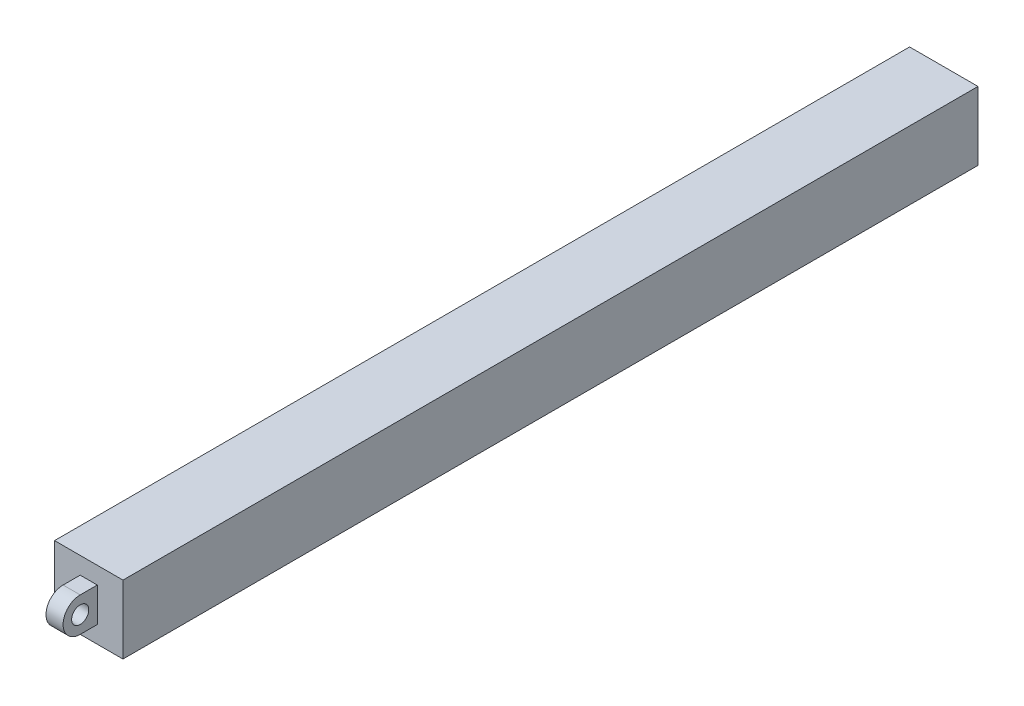
from build123d import *

# Parameters (mm, degrees)
SKETCH_2_W      = 125
SKETCH_2_H      = 10
EXTRUDE_1_DEPTH = 5
SKETCH_3_R      = 1.25
EXTRUDE_2_DEPTH = 1.25


with BuildPart() as part:
    # 스케치2 → 보스-돌출1 (new, symmetric)
    with BuildSketch(Plane(origin=(0, 0, 0), x_dir=(0, 0, -1), z_dir=(1, 0, 0))):
        Rectangle(SKETCH_2_W, SKETCH_2_H)
    extrude(amount=EXTRUDE_1_DEPTH, both=True)

    # 스케치3 → 보스-돌출2 (add, symmetric)
    with BuildSketch(Plane(origin=(0, 0, 0), x_dir=(0, 0, -1), z_dir=(1, 0, 0))):
        with BuildLine():
            Line((-65, 2.5), (-62.5, 2.5))
            Line((-62.5, 2.5), (-62.5, -2.5))
            Line((-62.5, -2.5), (-65, -2.5))
            ThreePointArc((-65, -2.5), (-67.5, 0), (-65, 2.5))
        make_face()
        with Locations((-65, 0)):
            Circle(SKETCH_3_R, mode=Mode.SUBTRACT)
    extrude(amount=EXTRUDE_2_DEPTH, both=True)


solid = part.part
